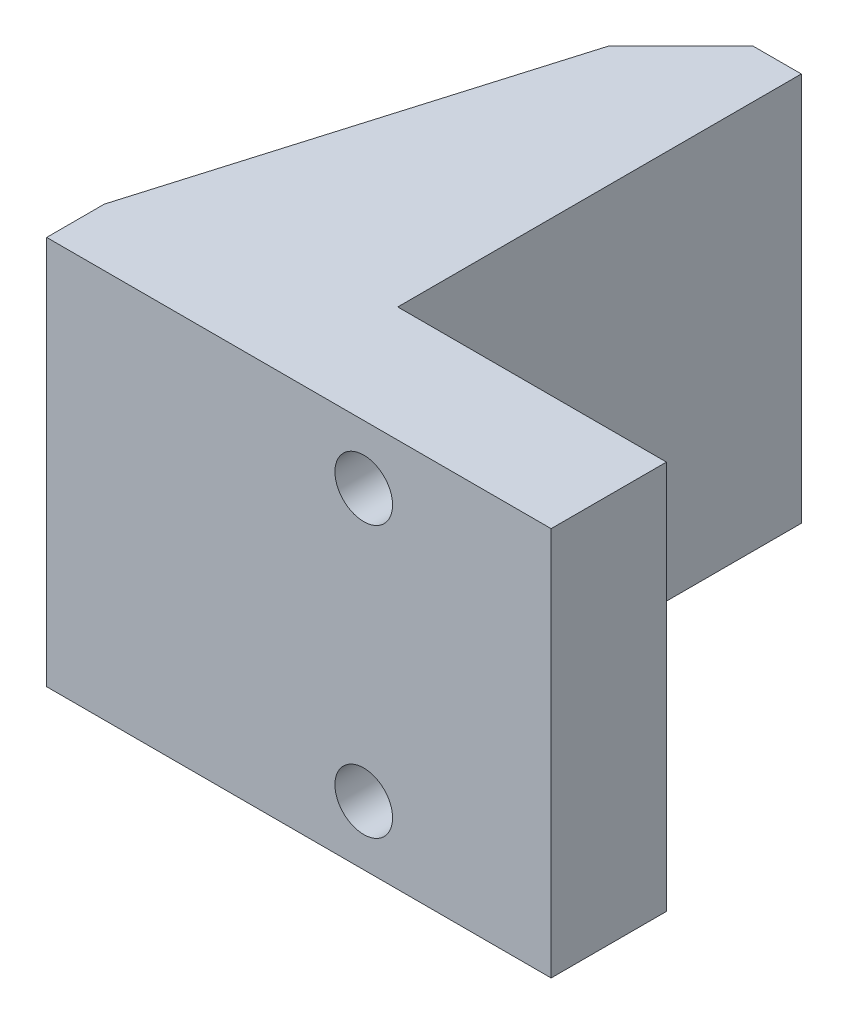
from build123d import *

# Parameters (mm, degrees)
SKETCH1_W           = 17.145
SKETCH1_H           = 17.145
BOSS_EXTRUDE1_DEPTH = 5.08
SKETCH2_R           = 1.27
CUT_EXTRUDE1_DEPTH  = 25.773139688
SKETCH3_R           = 2.54
CUT_EXTRUDE4_DEPTH  = 2.54
SKETCH4_W           = 6.307704678
SKETCH4_H           = 17.145
BOSS_EXTRUDE2_DEPTH = 17.78
SKETCH5_W           = 2.54
SKETCH5_H           = 17.145
BOSS_EXTRUDE3_DEPTH = 5.08
CHAMFER1_SIZE       = 3.175
BOSS_EXTRUDE4_DEPTH = 2.54
BOSS_EXTRUDE5_DEPTH = 2.54
SKETCH9_W           = 1
SKETCH9_H           = 17.145
CUT_EXTRUDE5_DEPTH  = 17.78


with BuildPart() as part:
    # Sketch1 → Boss-Extrude1 (new body)
    with BuildSketch(Plane.XY):
        with Locations((8.5725, -8.5725)):
            Rectangle(SKETCH1_W, SKETCH1_H)
    extrude(amount=BOSS_EXTRUDE1_DEPTH)

    # Sketch2 → Cut-Extrude1 (cut, through all)
    with BuildSketch(Plane(origin=(0, 0, 0), x_dir=(-1, 0, 0), z_dir=(0, 0, -1))):
        with Locations((-8.89, -2.5908)):
            Circle(SKETCH2_R)
        with Locations((-8.89, -14.5288)):
            Circle(SKETCH2_R)
    extrude(amount=-CUT_EXTRUDE1_DEPTH, mode=Mode.SUBTRACT)

    # Sketch3 → Cut-Extrude4 (cut)
    with BuildSketch(Plane(origin=(0, 0, 0), x_dir=(-1, 0, 0), z_dir=(0, 0, -1))):
        with Locations((-8.89, -2.5908)):
            Circle(SKETCH3_R)
        with Locations((-8.89, -14.5288)):
            Circle(SKETCH3_R)
    extrude(amount=-CUT_EXTRUDE4_DEPTH, mode=Mode.SUBTRACT)

    # Sketch4 → Boss-Extrude2 (add)
    with BuildSketch(Plane(origin=(0, 0, 0), x_dir=(-1, 0, 0), z_dir=(0, 0, -1))):
        with Locations((-3.153852339, -8.5725)):
            Rectangle(SKETCH4_W, SKETCH4_H)
    extrude(amount=BOSS_EXTRUDE2_DEPTH)

    # Sketch5 → Boss-Extrude3 (add)
    with BuildSketch(Plane.ZY):
        with Locations((3.81, -8.5725)):
            Rectangle(SKETCH5_W, SKETCH5_H)
    extrude(amount=BOSS_EXTRUDE3_DEPTH)

    # Chamfer1
    chamfer1_edges = [part.edges().sort_by_distance(p)[0] for p in [
        (0, -8.5725, -17.78),
    ]]
    chamfer(chamfer1_edges, length=CHAMFER1_SIZE)

    # Sketch7 → Boss-Extrude4 (add)
    with BuildSketch(Plane(origin=(0, 0, 0), x_dir=(1, 0, 0), z_dir=(0, 1, 0))):
        Polygon((-5.08, -2.54), (0, 14.605), (0, -2.54), align=None)
    extrude(amount=-BOSS_EXTRUDE4_DEPTH)

    # Sketch8 → Boss-Extrude5 (add)
    with BuildSketch(Plane.XZ.offset(17.145)):
        Polygon((0, 2.54), (-5.08, 2.54), (0, -14.605), align=None)
    extrude(amount=-BOSS_EXTRUDE5_DEPTH)

    # Sketch9 → Cut-Extrude5 (cut)
    with BuildSketch(Plane(origin=(0, 0, -17.78), x_dir=(-1, 0, 0), z_dir=(0, 0, -1))):
        with Locations((-5.807704678, -8.5725)):
            Rectangle(SKETCH9_W, SKETCH9_H)
    extrude(amount=-CUT_EXTRUDE5_DEPTH, mode=Mode.SUBTRACT)


solid = part.part
